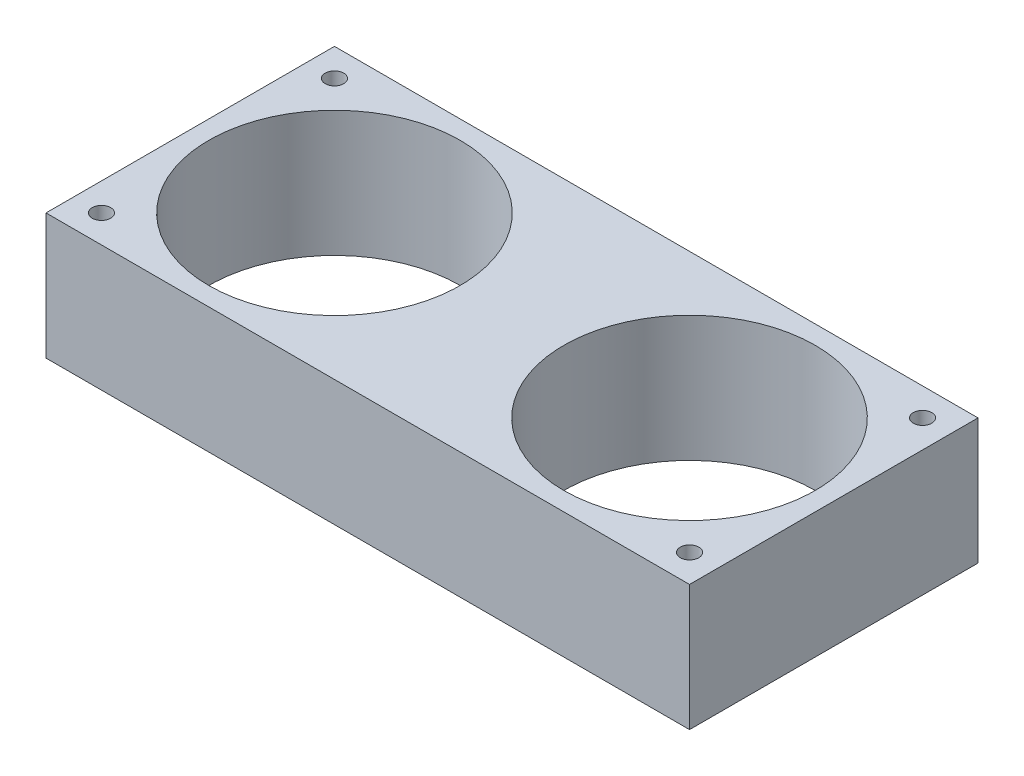
from build123d import *

# Parameters (mm, degrees)
SKETCH1_W           = 174
SKETCH1_H           = 78
SKETCH1_R           = 34
SKETCH1_R_2         = 2.5
BOSS_EXTRUDE1_DEPTH = 34


with BuildPart() as part:
    # Sketch1 → Boss-Extrude1 (new body)
    with BuildSketch(Plane(origin=(0, 0, 0), x_dir=(1, 0, 0), z_dir=(0, 1, 0))):
        Rectangle(SKETCH1_W, SKETCH1_H)
        with Locations(Location((48, 0, 0), (0, 0, 270))):
            Circle(SKETCH1_R, mode=Mode.SUBTRACT)
        with Locations(Location((-48, 0, 0), (0, 0, 270))):
            Circle(SKETCH1_R, mode=Mode.SUBTRACT)
        with Locations(Location((-79.5, 31.5, 0), (0, 0, 270))):
            Circle(SKETCH1_R_2, mode=Mode.SUBTRACT)
        with Locations(Location((-79.5, -31.5, 0), (0, 0, 270))):
            Circle(SKETCH1_R_2, mode=Mode.SUBTRACT)
        with Locations(Location((79.5, -31.5, 0), (0, 0, 270))):
            Circle(SKETCH1_R_2, mode=Mode.SUBTRACT)
        with Locations(Location((79.5, 31.5, 0), (0, 0, 270))):
            Circle(SKETCH1_R_2, mode=Mode.SUBTRACT)
    extrude(amount=BOSS_EXTRUDE1_DEPTH)


solid = part.part
